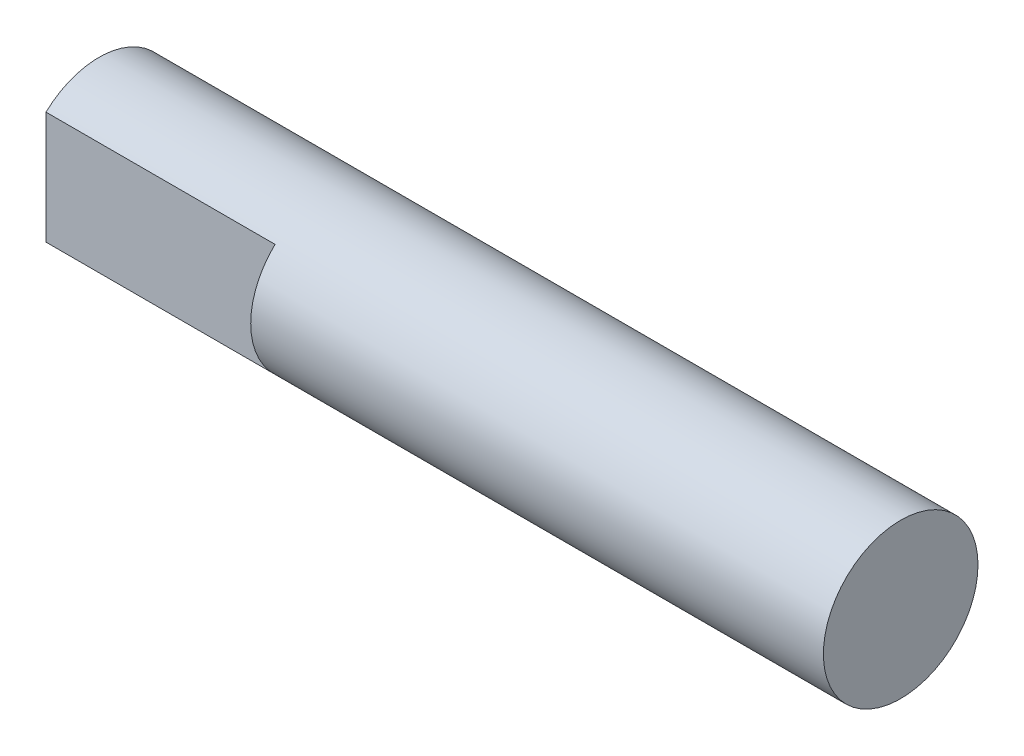
from build123d import *

# Parameters (mm, degrees)
SKETCH1_R                         = 2.7
BOSS_EXTRUDE1_DEPTH               = 18.5
CUT_EXTRUDE1_DEPTH                = 8
SKETCH3_R                         = 1
CUT_EXTRUDE2_DEPTH                = 6
CORTAR_EXTRUIR1_REACH             = 21.242
CORTAR_EXTRUIR1_DIRECTION_2_REACH = 21.242


with BuildPart() as part:
    # Sketch1 → Boss-Extrude1 (new, symmetric)
    with BuildSketch(Plane(origin=(0, 0, 0), x_dir=(0, 0, -1), z_dir=(1, 0, 0))):
        Circle(SKETCH1_R)
    extrude(amount=BOSS_EXTRUDE1_DEPTH, both=True)

    # Sketch2 → Cut-Extrude1 (cut)
    with BuildSketch(Plane(origin=(18.5, 0, 0), x_dir=(0, 0, -1), z_dir=(1, 0, 0))):
        with BuildLine():
            Line((-1.85, 1.966596044), (-1.85, -1.966596044))
            ThreePointArc((-1.85, -1.966596044), (-2.7, 0), (-1.85, 1.966596044))
        make_face()
        with BuildLine():
            Line((1.85, 1.966596044), (1.85, -1.966596044))
            ThreePointArc((1.85, -1.966596044), (2.7, 0), (1.85, 1.966596044))
        make_face()
    cut_extrude1 = extrude(amount=-CUT_EXTRUDE1_DEPTH, mode=Mode.SUBTRACT)

    # Sketch3 → Cut-Extrude2 (cut)
    with BuildSketch(Plane(origin=(18.5, 0, 0), x_dir=(0, 0, -1), z_dir=(1, 0, 0))):
        Circle(SKETCH3_R)
    cut_extrude2 = extrude(amount=-CUT_EXTRUDE2_DEPTH, mode=Mode.SUBTRACT)

    # Mirror1: Cut-Extrude1, Cut-Extrude2 across plane
    add(cut_extrude1.mirror(Plane(origin=(0, 0, 0), x_dir=(0, 0, 1), z_dir=(1, 0, 0))), mode=Mode.SUBTRACT)
    add(cut_extrude2.mirror(Plane(origin=(0, 0, 0), x_dir=(0, 0, 1), z_dir=(1, 0, 0))), mode=Mode.SUBTRACT)

    # Croquis1 → Cortar-Extruir1 (cut, up to next)
    with BuildSketch(Plane(origin=(0, 0, -1.85), x_dir=(-1, 0, 0), z_dir=(0, 0, -1)), mode=Mode.PRIVATE) as cortar_extruir1_sk1:
        Polygon((-9.5, -2.7), (-9.5, 3.118496514), (-19.119942129, 3.118496514), (-19.119942129, -3.62450436), (-9.5, -3.62450436), align=None)
    cortar_extruir1_tool1 = extrude(cortar_extruir1_sk1.sketch, amount=-CORTAR_EXTRUIR1_REACH, mode=Mode.PRIVATE) & part.part
    add(cortar_extruir1_tool1.solids().sort_by_distance((14.309971, -0.253004, -1.85))[0], mode=Mode.SUBTRACT)

    # Croquis1 → Cortar-Extruir1 direction 2 (cut, up to next)
    with BuildSketch(Plane(origin=(0, 0, -1.85), x_dir=(-1, 0, 0), z_dir=(0, 0, -1)), mode=Mode.PRIVATE) as cortar_extruir1_direction_2_sk1:
        Polygon((-9.5, -2.7), (-9.5, 3.118496514), (-19.119942129, 3.118496514), (-19.119942129, -3.62450436), (-9.5, -3.62450436), align=None)
    cortar_extruir1_direction_2_tool1 = extrude(cortar_extruir1_direction_2_sk1.sketch, amount=CORTAR_EXTRUIR1_DIRECTION_2_REACH, mode=Mode.PRIVATE) & part.part
    add(cortar_extruir1_direction_2_tool1.solids().sort_by_distance((14.309971, -0.253004, -1.85))[0], mode=Mode.SUBTRACT)


solid = part.part
